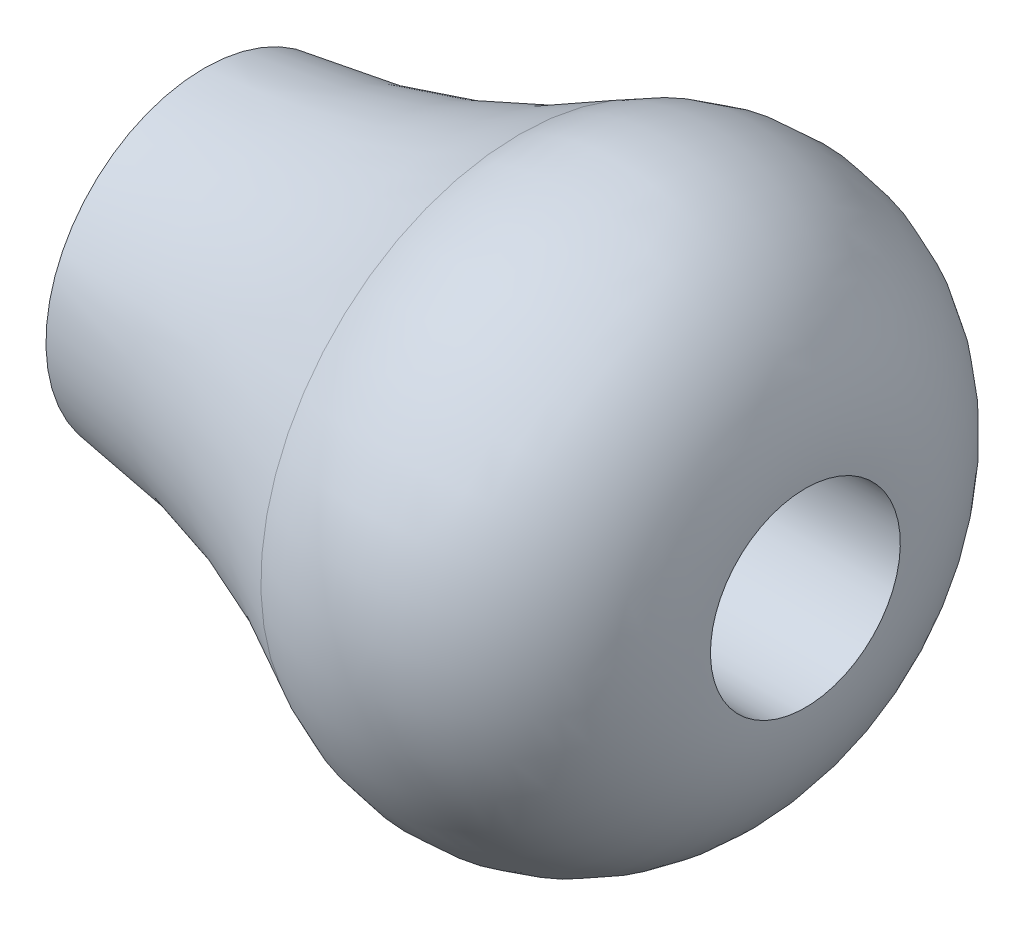
from build123d import *


with BuildPart() as part:
    # Sketch1 → Revolve1 (revolve)
    with BuildSketch(Plane.XY):
        with BuildLine():
            Line((0, 1.75), (5, 1.75))
            Line((5, 1.75), (5, 3))
            Line((5, 3), (19, 3))
            ThreePointArc((19, 3), (15.983650797, 8.205557408), (9.967390692, 8.177188502))
            ThreePointArc((9.967390692, 8.177188502), (5.160202017, 6.03486225), (0, 5))
            Line((0, 5), (0, 1.75))
        make_face()
    revolve(axis=Axis((0, 0, 0), (-1, 0, 0)))


solid = part.part
